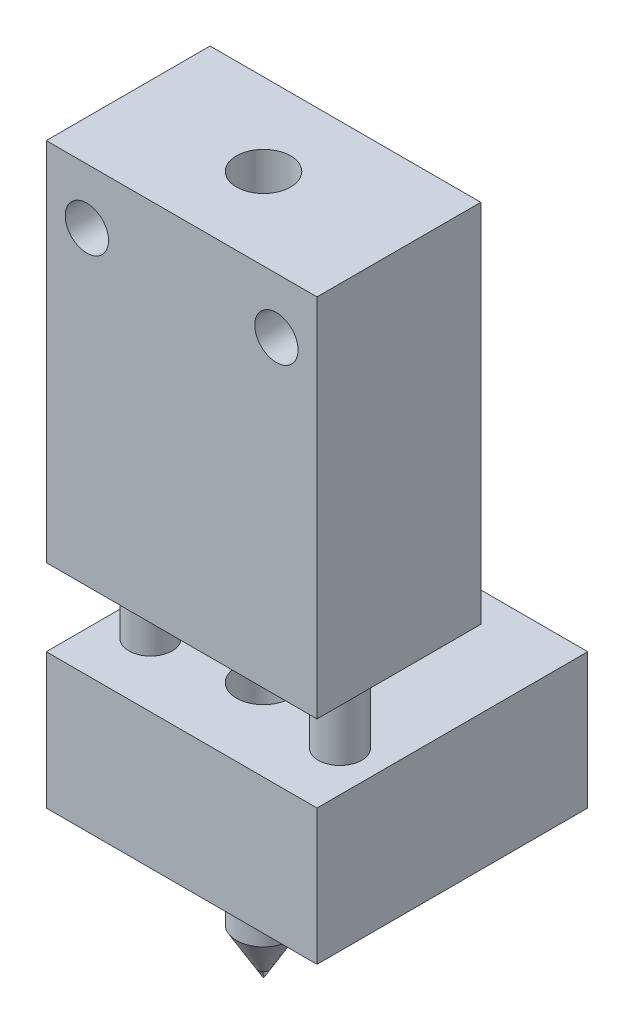
from build123d import *

# Parameters (mm, degrees)
SKETCH1_W           = 20
SKETCH1_H           = 27
SKETCH1_R           = 1.6
BOSS_EXTRUDE1_DEPTH = 12.1
SKETCH2_W           = 20
SKETCH2_H           = 10
BOSS_EXTRUDE2_DEPTH = 20
BOSS_EXTRUDE3_REACH = 37.713
SKETCH3_R           = 1.6
CUT_EXTRUDE1_REACH  = 50.68
SKETCH4_R           = 2


with BuildPart() as part:
    # Sketch1 → Boss-Extrude1 (new body)
    with BuildSketch(Plane.XY):
        with Locations((10, 13.5)):
            Rectangle(SKETCH1_W, SKETCH1_H)
        with Locations((3, 22.9)):
            Circle(SKETCH1_R, mode=Mode.SUBTRACT)
        with Locations((17, 22.9)):
            Circle(SKETCH1_R, mode=Mode.SUBTRACT)
    extrude(amount=BOSS_EXTRUDE1_DEPTH)


with BuildPart() as body_2:
    # Sketch2 → Boss-Extrude2 (new body)
    with BuildSketch(Plane.ZY):
        with Locations((2.1, -10.7)):
            Rectangle(SKETCH2_W, SKETCH2_H)
    extrude(amount=-BOSS_EXTRUDE2_DEPTH)

    # Sketch3 → Boss-Extrude3 (add, up to next)
    with BuildSketch(Plane.XZ, mode=Mode.PRIVATE) as boss_extrude3_sk1:
        with Locations(Location((3, 7.4, 0), (0, 0, 90))):
            Circle(SKETCH3_R)
    boss_extrude3_tool1 = extrude(boss_extrude3_sk1.sketch, amount=BOSS_EXTRUDE3_REACH, mode=Mode.PRIVATE) - body_2.part
    # Sketch3 → Boss-Extrude3 (add, up to next)
    with BuildSketch(Plane.XZ, mode=Mode.PRIVATE) as boss_extrude3_sk2:
        with Locations(Location((17, 7.4, 0), (0, 0, 90))):
            Circle(SKETCH3_R)
    boss_extrude3_tool2 = extrude(boss_extrude3_sk2.sketch, amount=BOSS_EXTRUDE3_REACH, mode=Mode.PRIVATE) - body_2.part

    add(part.part)  # Boss-Extrude3 merges part
    add(boss_extrude3_tool1.solids().sort_by_distance((3, 0, 7.4))[0])
    add(boss_extrude3_tool2.solids().sort_by_distance((17, 0, 7.4))[0])

    # Cut-Extrude1: up to this face of the body (flat: up to its plane)
    cut_extrude1_end = Plane(body_2.part.faces().sort_by_distance((10, -15.7, 2.1))[0])
    # Sketch4 → Cut-Extrude1 (cut, up to the picked face)
    with BuildSketch(Plane(origin=(0, 27, 0), x_dir=(1, 0, 0), z_dir=(0, 1, 0)), mode=Mode.PRIVATE) as cut_extrude1_sk1:
        with Locations(Location((10, -6.05, 0), (0, 0, 270))):
            Circle(SKETCH4_R)
    cut_extrude1_tool1 = split(extrude(cut_extrude1_sk1.sketch, amount=-CUT_EXTRUDE1_REACH, mode=Mode.PRIVATE), bisect_by=cut_extrude1_end, keep=Keep.BOTH, mode=Mode.PRIVATE)
    add(cut_extrude1_tool1.solids().sort_by(Axis((10, 27, 6.05), (0, -1, 0)))[0], mode=Mode.SUBTRACT)


with BuildPart() as body_2_2:
    # Sketch6 → Revolve1 (revolve)
    with BuildSketch(Plane.XY.offset(6.05)):
        Polygon((8, -15.7), (10, -15.7), (10, -24.6), (8, -21.2), align=None)
    revolve(axis=Axis((10, -15.7, 6.05), (0, -1, 0)))


solid = Compound([body_2.part, body_2_2.part])
